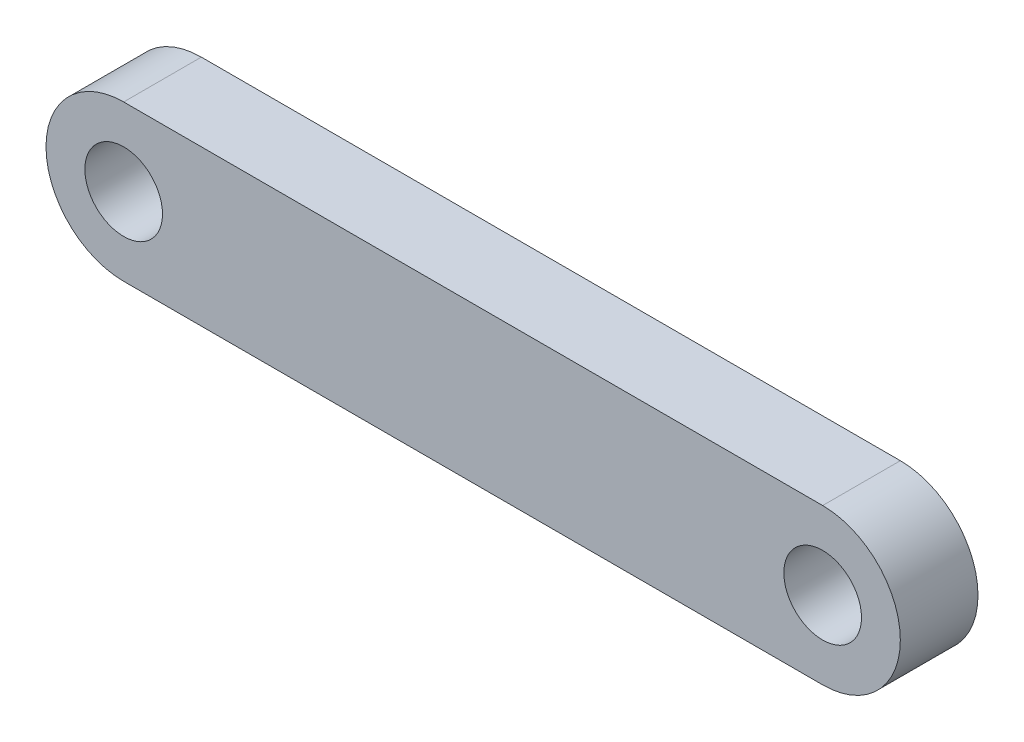
from build123d import *

# Parameters (mm, degrees)
SKETCH_1_R      = 1.5
EXTRUDE_1_DEPTH = 3


with BuildPart() as part:
    # 草图1 → 凸台-拉伸1 (new body)
    with BuildSketch(Plane.XY):
        with BuildLine():
            Line((-13.5, 3), (13.5, 3))
            ThreePointArc((13.5, 3), (16.5, 0), (13.5, -3))
            Line((13.5, -3), (-13.5, -3))
            ThreePointArc((-13.5, -3), (-16.5, 0), (-13.5, 3))
        make_face()
        with Locations((13.5, 0)):
            Circle(SKETCH_1_R, mode=Mode.SUBTRACT)
        with Locations((-13.5, 0)):
            Circle(SKETCH_1_R, mode=Mode.SUBTRACT)
    extrude(amount=EXTRUDE_1_DEPTH)


solid = part.part
